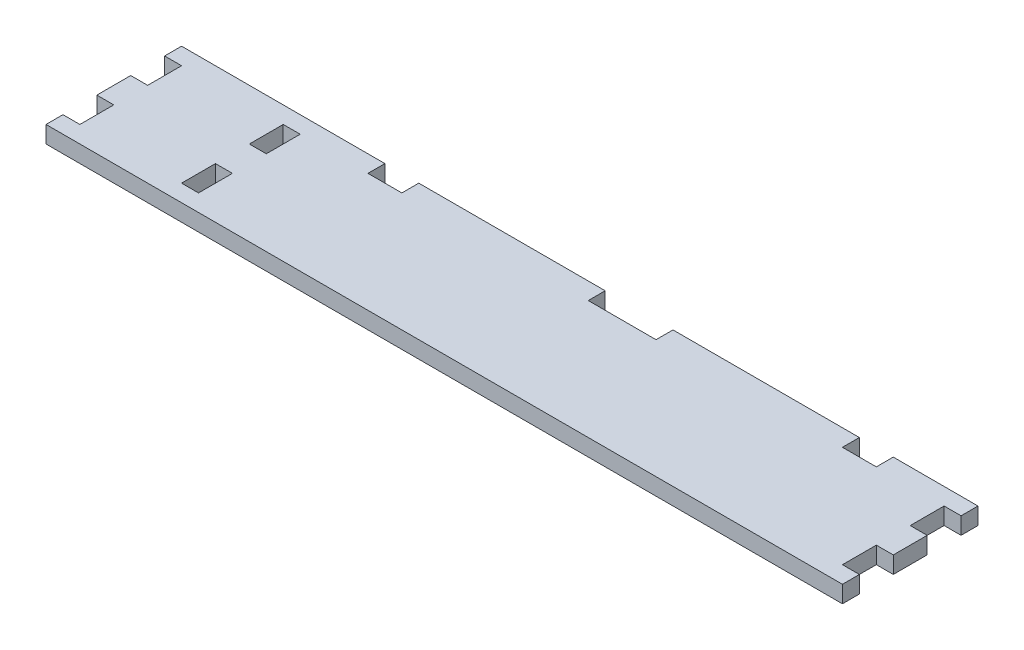
from build123d import *

# Parameters (mm, degrees)
SKETCH_1_W      = 5
SKETCH_1_H      = 10
EXTRUDE_1_DEPTH = 5


with BuildPart() as part:
    # 草图1 → 凸台-拉伸1 (new body)
    with BuildSketch(Plane(origin=(0, 0, 0), x_dir=(1, 0, 0), z_dir=(0, 1, 0))):
        Polygon((0, 0), (200, 0), (200, 5), (195, 5), (195, 15), (200, 15), (200, 25), (195, 25), (195, 35), (200, 35), (200, 40), (175, 40), (175, 35), (165, 35), (165, 40), (110, 40), (110, 35), (90, 35), (90, 40), (35, 40), (35, 35), (25, 35), (25, 40), (0, 40), (-35, 40), (-35, 35), (-30, 35), (-30, 25), (-35, 25), (-35, 15), (-30, 15), (-30, 5), (-35, 5), (-35, 0), align=None)
        with Locations((2.5, 30)):
            Rectangle(SKETCH_1_W, SKETCH_1_H, mode=Mode.SUBTRACT)
        with Locations((2.5, 10)):
            Rectangle(SKETCH_1_W, SKETCH_1_H, mode=Mode.SUBTRACT)
    extrude(amount=EXTRUDE_1_DEPTH)


solid = part.part
